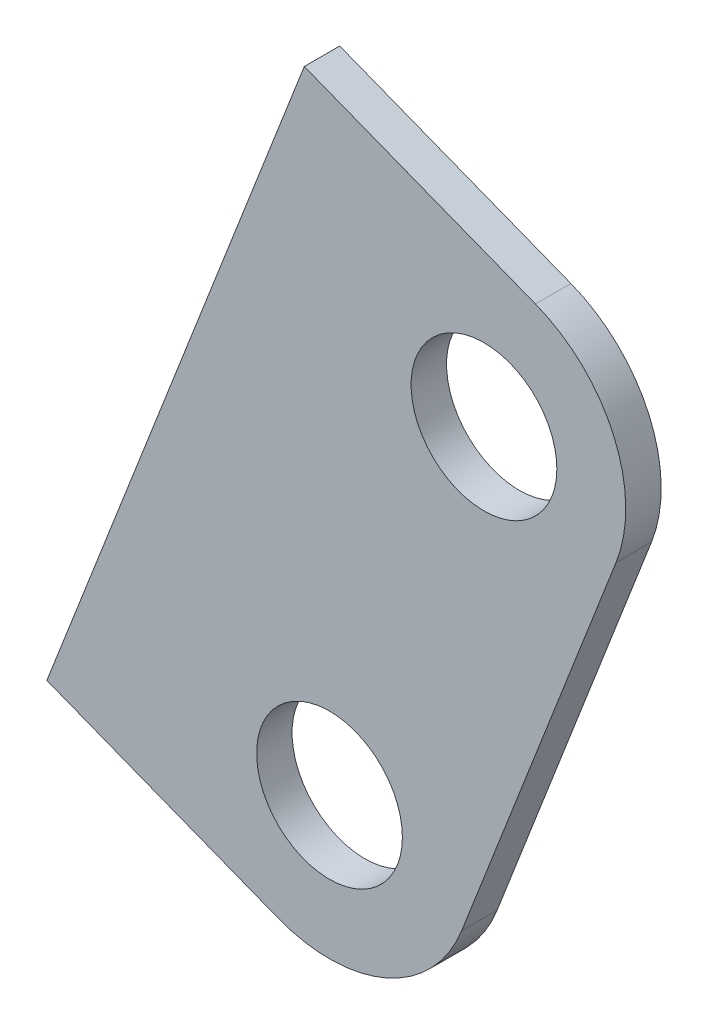
from build123d import *

# Parameters (mm, degrees)
SKETCH58_R          = 3.2639
BOSS_EXTRUDE1_DEPTH = 0.79375


with BuildPart() as part:
    # Sketch58 → Boss-Extrude1 (new, symmetric)
    with BuildSketch(Plane.XY.offset(-139.7)):
        with BuildLine():
            Line((-65.080499238, 1085.818309343), (-54.72678345, 1081.782441948))
            ThreePointArc((-54.72678345, 1081.782441948), (-51.218723763, 1078.418829178), (-51.116584369, 1073.559822986))
            Line((-51.116584369, 1073.559822986), (-58.03521419, 1055.810595921))
            ThreePointArc((-58.03521419, 1055.810595921), (-61.398826959, 1052.302536234), (-66.257833152, 1052.20039684))
            Line((-66.257833152, 1052.20039684), (-76.611548939, 1056.236264235))
            Line((-76.611548939, 1056.236264235), (-65.080499238, 1085.818309343))
        make_face()
        with Locations((-57.03299339, 1075.866032926)):
            Circle(SKETCH58_R, mode=Mode.SUBTRACT)
        with Locations((-63.951623211, 1058.116805861)):
            Circle(SKETCH58_R, mode=Mode.SUBTRACT)
    extrude(amount=BOSS_EXTRUDE1_DEPTH, both=True)


solid = part.part
